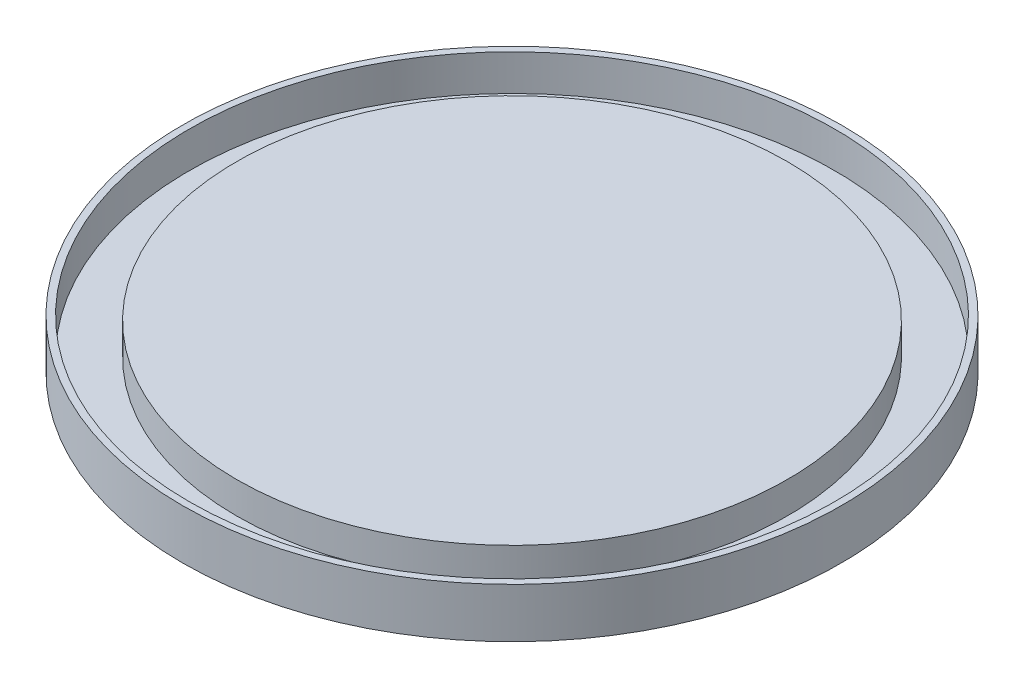
from build123d import *

# Parameters (mm, degrees)
SKETCH_1_R      = 73
SKETCH_1_R_2    = 71.5
EXTRUDE_1_DEPTH = 11
SKETCH_2_R      = 71.5
SKETCH_2_R_2    = 61
EXTRUDE_2_DEPTH = 3
SKETCH_3_R      = 61
SKETCH_3_R_2    = 59.5
EXTRUDE_3_DEPTH = 10
EXTRUDE_START   = 7
SKETCH_4_R      = 59.5
EXTRUDE_4_DEPTH = 3
EXTRUDE_5_DEPTH = 7


with BuildPart() as part:
    # 스케치1 → 보스-돌출1 (new body)
    with BuildSketch(Plane(origin=(0, 0, 0), x_dir=(1, 0, 0), z_dir=(0, 1, 0))):
        with Locations(Location((0, 0, 0), (0, 0, 270))):
            Circle(SKETCH_1_R)
        with Locations(Location((0, 0, 0), (0, 0, 270))):
            Circle(SKETCH_1_R_2, mode=Mode.SUBTRACT)
    extrude(amount=EXTRUDE_1_DEPTH)

    # 스케치2 → 보스-돌출2 (add)
    with BuildSketch(Plane(origin=(0, 0, 0), x_dir=(1, 0, 0), z_dir=(0, 1, 0))):
        with Locations(Location((0, 0, 0), (0, 0, 270))):
            Circle(SKETCH_2_R)
        with Locations(Location((0, 0, 0), (0, 0, 270))):
            Circle(SKETCH_2_R_2, mode=Mode.SUBTRACT)
    extrude(amount=EXTRUDE_2_DEPTH)

    # 스케치3 → 보스-돌출3 (add)
    with BuildSketch(Plane(origin=(0, 0, 0), x_dir=(1, 0, 0), z_dir=(0, 1, 0))):
        with Locations(Location((0, 0, 0), (0, 0, 270))):
            Circle(SKETCH_3_R)
        with Locations(Location((0, 0, 0), (0, 0, 270))):
            Circle(SKETCH_3_R_2, mode=Mode.SUBTRACT)
    extrude(amount=EXTRUDE_3_DEPTH)

    # 스케치4 → 보스-돌출4 (add)
    with BuildSketch(Plane(origin=(0, 0, 0), x_dir=(1, 0, 0), z_dir=(0, 1, 0)).offset(EXTRUDE_START)):
        with Locations(Location((0, 0, 0), (0, 0, 270))):
            Circle(SKETCH_4_R)
    extrude(amount=EXTRUDE_4_DEPTH)

    # 스케치6 → 보스-돌출5 (add)
    with BuildSketch(Plane.XZ.offset(-7).offset(EXTRUDE_START)):
        with BuildLine():
            Line((-1.804298071, 9.835878632), (-10.73557352, 58.523477863))
            ThreePointArc((-10.73557352, 58.523477863), (-8.172597382, 58.93605562), (-5.594064241, 59.236445245))
            Line((-5.594064241, 59.236445245), (-0.940178864, 9.955705083))
            ThreePointArc((-0.940178864, 9.955705083), (7.891398769, 6.142135253), (9.4202698, -3.355371351))
            Line((9.4202698, -3.355371351), (56.050605307, -19.964459539))
            ThreePointArc((56.050605307, -19.964459539), (55.126420057, -22.390350862), (54.097298532, -24.77362088))
            Line((54.097298532, -24.77362088), (9.091982947, -4.163633761))
            ThreePointArc((9.091982947, -4.163633761), (1.373545779, -9.905219432), (-7.615971729, -6.480507281))
            Line((-7.615971729, -6.480507281), (-45.315031787, -38.559018324))
            ThreePointArc((-45.315031787, -38.559018324), (-46.953822675, -36.545704758), (-48.503234292, -34.462824365))
            Line((-48.503234292, -34.462824365), (-8.151804083, -5.792071322))
            ThreePointArc((-8.151804083, -5.792071322), (-9.264944547, 3.763084178), (-1.804298071, 9.835878632))
        make_face()
    extrude(amount=-EXTRUDE_5_DEPTH)


solid = part.part
